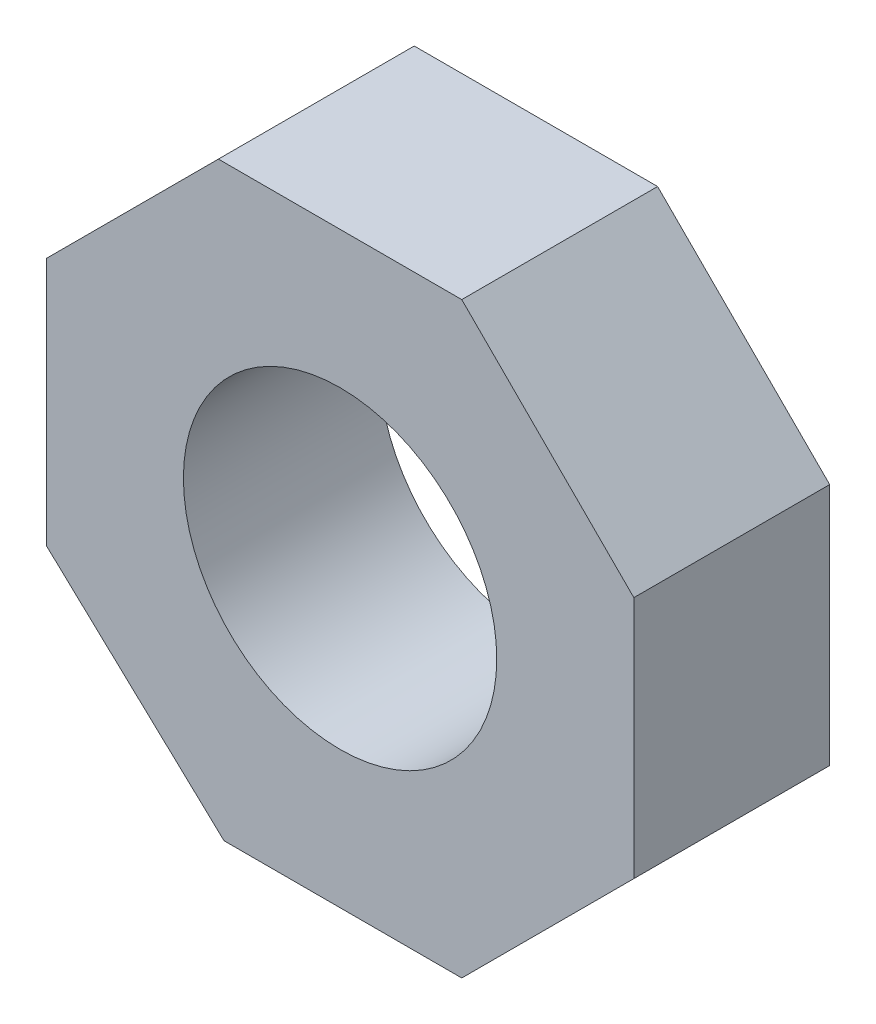
from build123d import *

# Parameters (mm, degrees)
ESQUISSE1_R        = 4
BOSS_EXTRU_1_DEPTH = 5


with BuildPart() as part:
    # Esquisse1 → Boss.-Extru.1 (new body)
    with BuildSketch(Plane.XY):
        Polygon((7.5, 3.106601718), (5.303300859, 5.303300859), (3.106601718, 7.5), (-3.106601718, 7.5), (-5.303300859, 5.303300859), (-7.5, 3.106601718), (-7.5, -3.242345642), (-5.303300859, -5.303300859), (-2.961917079, -7.5), (3.106601718, -7.5), (5.303300859, -5.303300859), (7.5, -3.106601718), align=None)
        Circle(ESQUISSE1_R, mode=Mode.SUBTRACT)
    extrude(amount=BOSS_EXTRU_1_DEPTH)


solid = part.part
